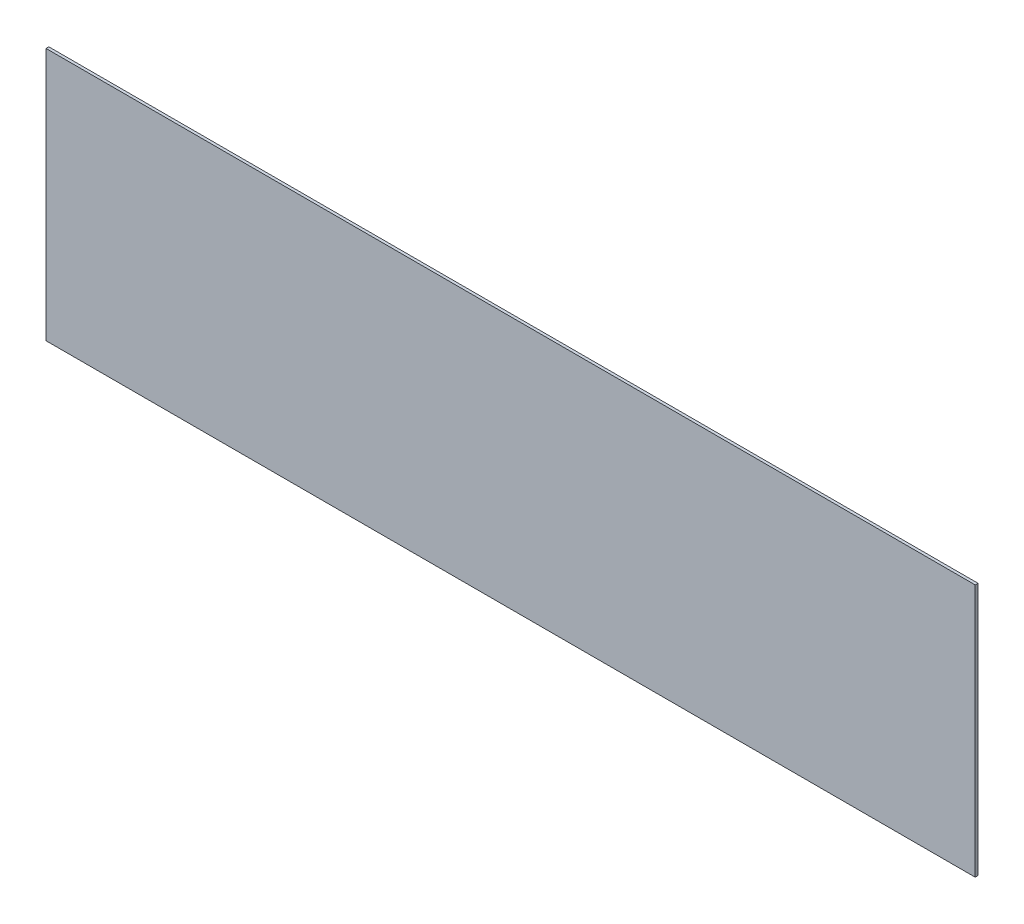
from build123d import *

# Parameters (mm, degrees)
SKETCH1_W           = 991
SKETCH1_H           = 270
BOSS_EXTRUDE1_DEPTH = 3


with BuildPart() as part:
    # Sketch1 → Boss-Extrude1 (new body)
    with BuildSketch(Plane.XY):
        Rectangle(SKETCH1_W, SKETCH1_H)
    extrude(amount=BOSS_EXTRUDE1_DEPTH)


solid = part.part
